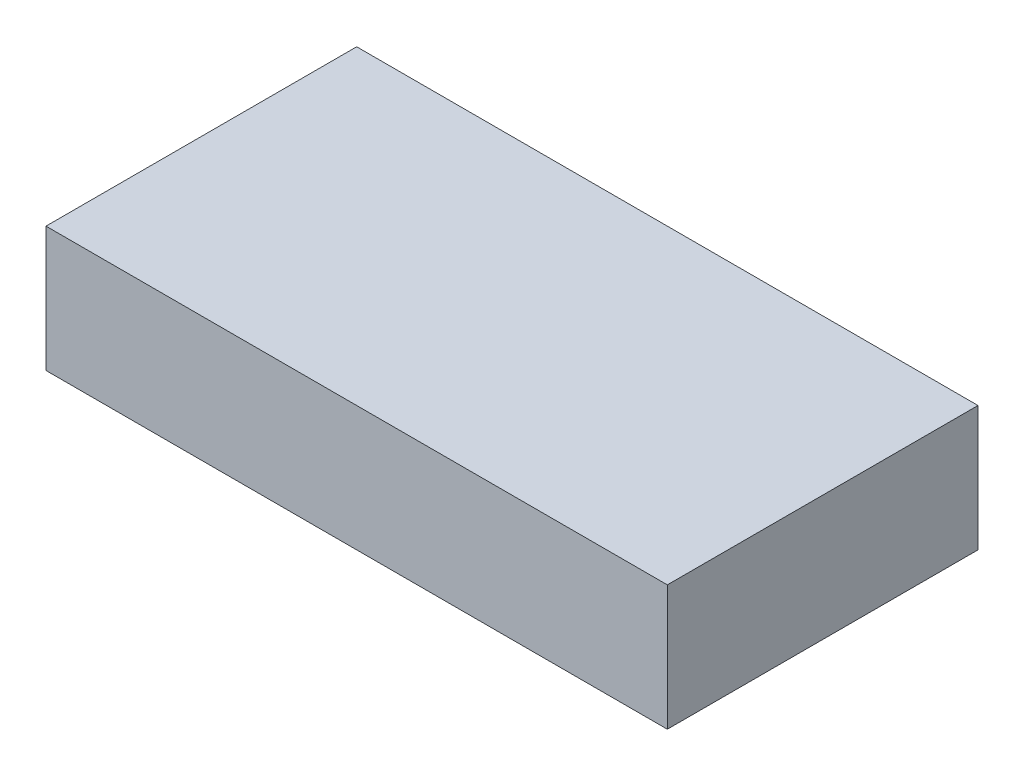
from build123d import *

# Parameters (mm, degrees)
SKETCH1_W           = 15.9
SKETCH1_H           = 7.95
BOSS_EXTRUDE1_DEPTH = 3.2
SHELL1_T            = -1.2


with BuildPart() as part:
    # Sketch1 → Boss-Extrude1 (new body)
    with BuildSketch(Plane(origin=(0, 0, 0), x_dir=(1, 0, 0), z_dir=(0, 1, 0))):
        Rectangle(SKETCH1_W, SKETCH1_H)
    extrude(amount=BOSS_EXTRUDE1_DEPTH)

    # Shell1
    shell1_openings = [part.faces().sort_by_distance(p)[0] for p in [
        (0, 0, 0),
    ]]
    offset(amount=SHELL1_T, openings=shell1_openings, kind=Kind.INTERSECTION)


solid = part.part
